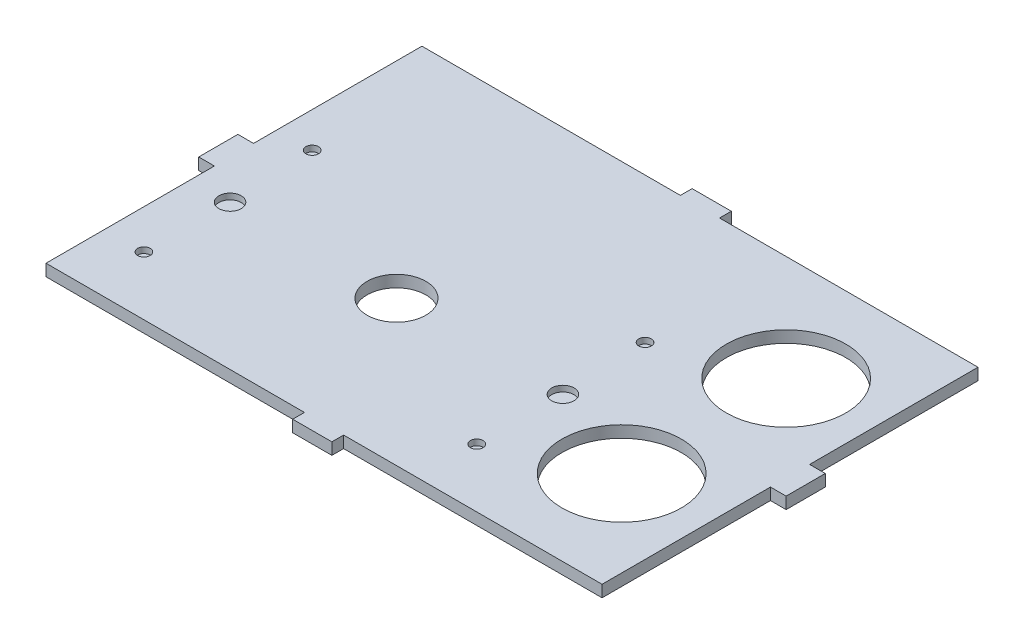
from build123d import *

# Parameters (mm, degrees)
EXTRUDE_1_DEPTH     = 3
SKETCH_2_R          = 1.6
SKETCH_2_R_2        = 2.85
CUT_EXTRUDE_3_DEPTH = 1.5
SKETCH_3_R          = 7.5
SKETCH_3_R_2        = 15.25
CUT_EXTRUDE_4_DEPTH = 3


with BuildPart() as part:
    # 草图1 → 凸台-拉伸1 (new body)
    with BuildSketch(Plane(origin=(0, 0, 0), x_dir=(1, 0, 0), z_dir=(0, 1, 0))):
        Polygon((5, 48), (71, 48), (71, 5), (75, 5), (75, -5), (71, -5), (71, -48), (5, -48), (5, -51), (-5, -51), (-5, -48), (-71, -48), (-71, -5), (-75, -5), (-75, 5), (-71, 5), (-71, 48), (-5, 48), (-5, 51), (5, 51), align=None)
    extrude(amount=EXTRUDE_1_DEPTH)

    # 草图2 → 切除-拉伸3 (cut)
    with BuildSketch(Plane(origin=(0, 3, 0), x_dir=(1, 0, 0), z_dir=(0, 1, 0))):
        with Locations(Location((-61, -33, 0), (0, 0, 270))):
            Circle(SKETCH_2_R)
        with Locations(Location((24, -33, 0), (0, 0, 270))):
            Circle(SKETCH_2_R)
        with Locations(Location((-61, -11, 0), (0, 0, 270))):
            Circle(SKETCH_2_R_2)
        with Locations(Location((24, -11, 0), (0, 0, 270))):
            Circle(SKETCH_2_R_2)
        with Locations(Location((-61.99896854, 10.977307885, 0), (0, 0, 270))):
            Circle(SKETCH_2_R)
        with Locations(Location((23.00103146, 10.977307885, 0), (0, 0, 270))):
            Circle(SKETCH_2_R)
    extrude(amount=-CUT_EXTRUDE_3_DEPTH, mode=Mode.SUBTRACT)

    # 草图3 → 切除-拉伸4 (cut)
    with BuildSketch(Plane(origin=(0, 3, 0), x_dir=(1, 0, 0), z_dir=(0, 1, 0))):
        with Locations(Location((-18.5, -11, 0), (0, 0, 270))):
            Circle(SKETCH_3_R)
        with Locations(Location((49, -21, 0), (0, 0, 270))):
            Circle(SKETCH_3_R_2)
        with Locations(Location((49, 21, 0), (0, 0, 270))):
            Circle(SKETCH_3_R_2)
    extrude(amount=-CUT_EXTRUDE_4_DEPTH, mode=Mode.SUBTRACT)


solid = part.part
